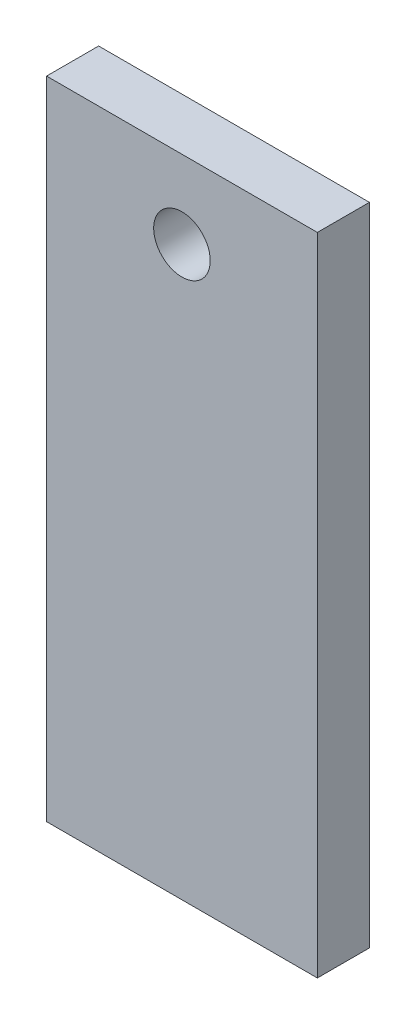
from build123d import *

# Parameters (mm, degrees)
ESQUISSE1_W                  = 26
ESQUISSE1_H                  = 62
ESQUISSE1_R                  = 2.715
BOSS_EXTRU_1_DEPTH           = 5
ENL_V_MAT_EXTRU_1_DEPTH      = 68.416615163
ENL_V_MAT_EXTRU_1_DEPTH_BACK = 60.5
CONG_3_R                     = 0.3


with BuildPart() as part:
    # Esquisse1 → Boss.-Extru.1 (new body)
    with BuildSketch(Plane.XY):
        with Locations((13, 31)):
            Rectangle(ESQUISSE1_W, ESQUISSE1_H)
        with Locations((13, 54.5)):
            Circle(ESQUISSE1_R, mode=Mode.SUBTRACT)
    extrude(amount=BOSS_EXTRU_1_DEPTH)

    # Esquisse3 → Enlèv. mat.-Extru.1 (cut, two sides: drawn at the far end of the back side and taken through both)
    with BuildSketch(Plane.XZ.offset(-ENL_V_MAT_EXTRU_1_DEPTH_BACK)):
        Polygon((3.154700538, 0), (2, 2), (2, 2.6), (8.109401077, 2.6), (8.109401077, 2), (6.954700538, 0), align=None)
        Polygon((19.045299462, 0), (17.890598923, 2), (17.890598923, 2.6), (24, 2.6), (24, 2), (22.845299462, 0), align=None)
    extrude(amount=ENL_V_MAT_EXTRU_1_DEPTH + ENL_V_MAT_EXTRU_1_DEPTH_BACK, mode=Mode.SUBTRACT)

    # Congé3
    cong_3_edges = [part.edges().sort_by_distance(p)[0] for p in [
        (3.154700538, 30.25, 0),
        (6.954700538, 30.25, 0),
        (19.045299462, 30.25, 0),
        (22.845299462, 30.25, 0),
    ]]
    fillet(cong_3_edges, radius=CONG_3_R)


solid = part.part
